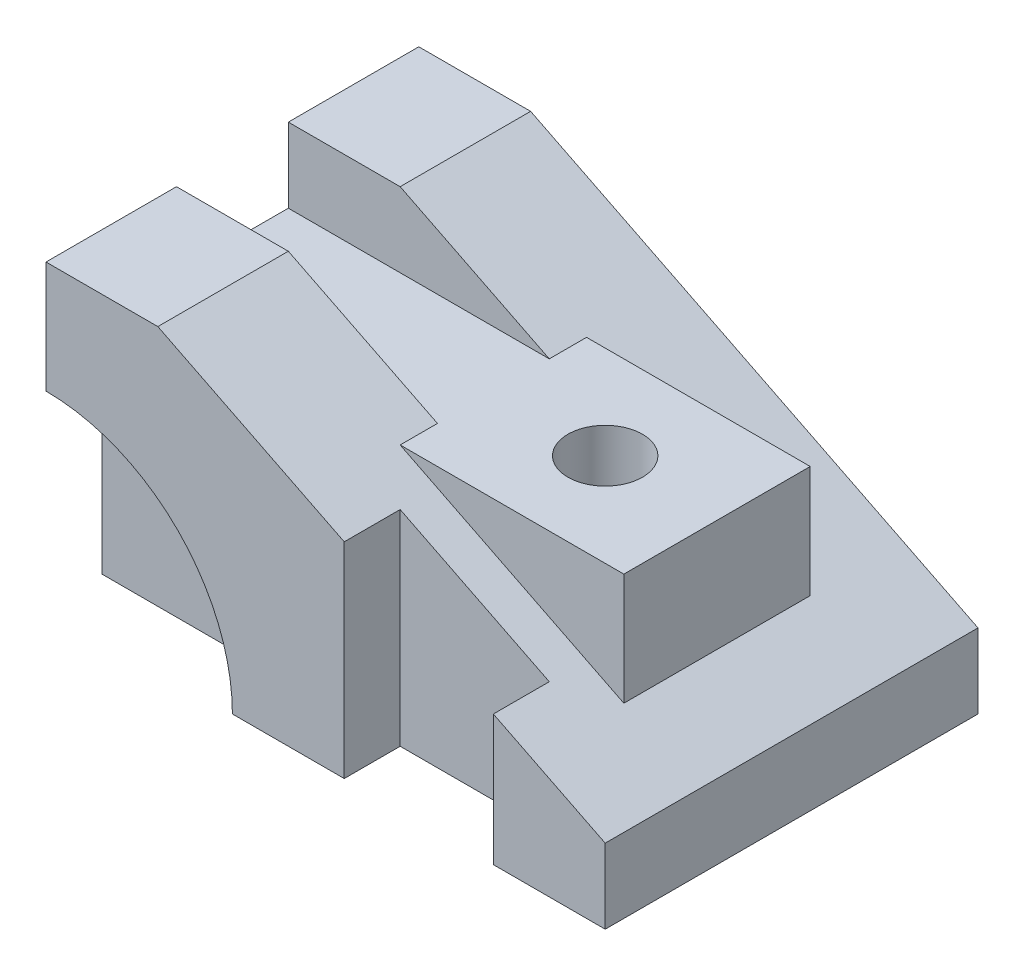
from build123d import *

# Parameters (mm, degrees)
BOSS_EXTRUDE1_DEPTH     = 50
BOSS_EXTRUDE2_DEPTH     = 25
CUT_EXTRUDE1_START      = 80
SKETCH2_W               = 70
SKETCH2_H               = 30
CUT_EXTRUDE1_DEPTH      = 20
SKETCH2_3_W             = 40
SKETCH2_3_H             = 15
CUT_EXTRUDE2_DEPTH      = 178.200451467
CUT_EXTRUDE3_DEPTH      = 178.200451467
CUT_EXTRUDE3_DEPTH_BACK = 178.200451467
SKETCH2_4_R             = 10
CUT_EXTRUDE4_DEPTH      = 178.200451467
CUT_EXTRUDE4_DEPTH_BACK = 15
CUT_EXTRUDE4_START      = 50
SKETCH3_R               = 50


with BuildPart() as part:
    # Sketch1 → Boss-Extrude1 (new, symmetric)
    with BuildSketch(Plane.XY):
        Polygon((70, 60), (130, 30), (150, 20), (150, 0), (0, 0), (0, 80), (30, 80), align=None)
    extrude(amount=BOSS_EXTRUDE1_DEPTH, both=True)

    # Sketch1<3> → Boss-Extrude2 (add, symmetric)
    with BuildSketch(Plane.XY):
        Polygon((70, 60), (130, 60), (130, 30), align=None)
    extrude(amount=BOSS_EXTRUDE2_DEPTH, both=True)

    # Sketch2 → Cut-Extrude1 (cut)
    with BuildSketch(Plane(origin=(0, 0, 0), x_dir=(1, 0, 0), z_dir=(0, 1, 0)).offset(CUT_EXTRUDE1_START)):
        with Locations((35, 0)):
            Rectangle(SKETCH2_W, SKETCH2_H)
    extrude(amount=-CUT_EXTRUDE1_DEPTH, mode=Mode.SUBTRACT)

    # Sketch2<3> → Cut-Extrude2 (cut, through all)
    with BuildSketch(Plane(origin=(0, 0, 0), x_dir=(1, 0, 0), z_dir=(0, 1, 0))):
        with Locations((100, -42.5)):
            Rectangle(SKETCH2_3_W, SKETCH2_3_H)
    extrude(amount=CUT_EXTRUDE2_DEPTH, mode=Mode.SUBTRACT)

    # Sketch2<4> → Cut-Extrude3 (cut, two sides: drawn at the far end of the back side and taken through both)
    with BuildSketch(Plane(origin=(0, 0, 0), x_dir=(1, 0, 0), z_dir=(0, 1, 0)).offset(-CUT_EXTRUDE3_DEPTH_BACK)):
        with Locations(Location((100, 0, 0), (0, 0, 270))):
            Circle(SKETCH2_4_R)
    extrude(amount=CUT_EXTRUDE3_DEPTH + CUT_EXTRUDE3_DEPTH_BACK, mode=Mode.SUBTRACT)

    # Sketch3 → Cut-Extrude4 (cut, two sides: drawn at the far end of the back side and taken through both)
    with BuildSketch(Plane.XY.offset(CUT_EXTRUDE4_START - CUT_EXTRUDE4_DEPTH_BACK)):
        Circle(SKETCH3_R)
    extrude(amount=CUT_EXTRUDE4_DEPTH + CUT_EXTRUDE4_DEPTH_BACK, mode=Mode.SUBTRACT)


solid = part.part
